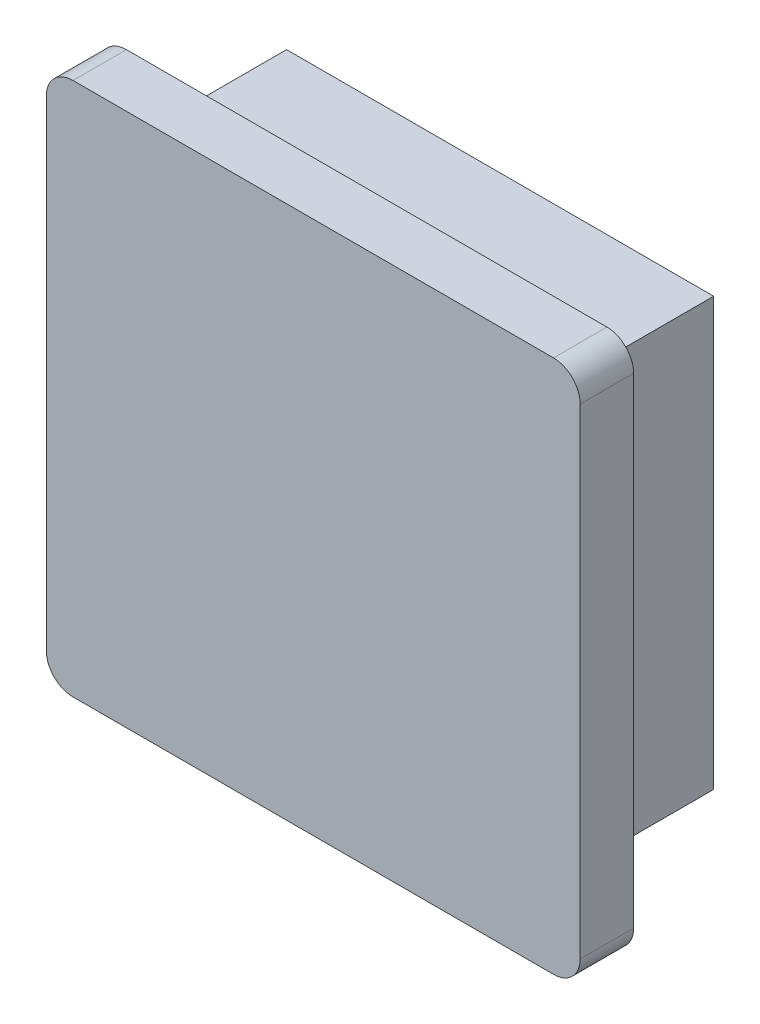
from build123d import *

# Parameters (mm, degrees)
SZKIC1_W                    = 20
SZKIC1_H                    = 20
DODANIE_WYCI_GNI_CIE1_DEPTH = 2
SZKIC1_4_W                  = 16
SZKIC1_4_H                  = 16
SZKIC1_4_W_2                = 14
SZKIC1_4_H_2                = 14
DODANIE_WYCI_GNI_CIE2_DEPTH = 5
ZAOKR_GLENIE1_R             = 1


with BuildPart() as part:
    # Szkic1 → Dodanie-wyciągnięcie1 (new body)
    with BuildSketch(Plane.XY):
        with Locations((10, 10)):
            Rectangle(SZKIC1_W, SZKIC1_H)
    extrude(amount=DODANIE_WYCI_GNI_CIE1_DEPTH)

    # Szkic1<4> → Dodanie-wyciągnięcie2 (add)
    with BuildSketch(Plane.XY):
        with Locations((10, 10)):
            Rectangle(SZKIC1_4_W, SZKIC1_4_H)
        with Locations((10, 10)):
            Rectangle(SZKIC1_4_W_2, SZKIC1_4_H_2, mode=Mode.SUBTRACT)
    extrude(amount=-DODANIE_WYCI_GNI_CIE2_DEPTH)

    # Zaokrąglenie1
    zaokr_glenie1_edges = [part.edges().sort_by_distance(p)[0] for p in [
        (20, 0, 1),
        (0, 0, 1),
        (20, 20, 1),
        (0, 20, 1),
    ]]
    fillet(zaokr_glenie1_edges, radius=ZAOKR_GLENIE1_R)


solid = part.part
